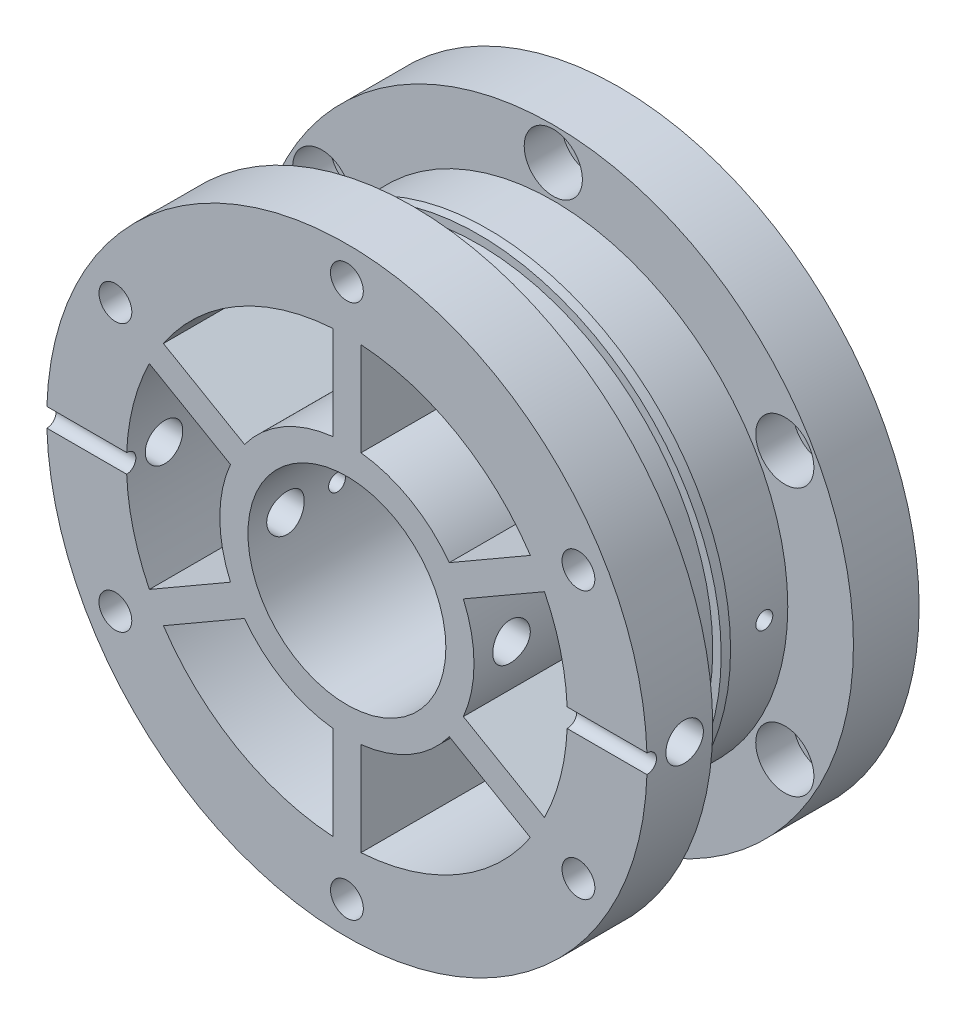
from build123d import *

# Parameters (mm, degrees)
SKETCH4_R                = 10.55
CUT_EXTRUDE1_DEPTH       = 45
SKETCH5_R                = 1.75
CUT_EXTRUDE2_DEPTH       = 20
SKETCH14_R               = 3.1
CUT_EXTRUDE9_DEPTH       = 4
CIRPATTERN1_COUNT        = 6
MIRROR1_COPY_1_SKETCH_R  = 1.75
MIRROR1_COPY_1_DEPTH     = 20
MIRROR1_COPY_2_SKETCH_R  = 1.75
MIRROR1_COPY_2_DEPTH     = 20
MIRROR1_COPY_3_SKETCH_R  = 1.75
MIRROR1_COPY_3_DEPTH     = 20
MIRROR1_COPY_4_SKETCH_R  = 1.75
MIRROR1_COPY_4_DEPTH     = 20
MIRROR1_COPY_5_SKETCH_R  = 1.75
MIRROR1_COPY_5_DEPTH     = 20
MIRROR1_COPY_6_SKETCH_R  = 3.1
MIRROR1_COPY_6_DEPTH     = 4
MIRROR1_COPY_7_SKETCH_R  = 3.1
MIRROR1_COPY_7_DEPTH     = 4
MIRROR1_COPY_8_SKETCH_R  = 3.1
MIRROR1_COPY_8_DEPTH     = 4
MIRROR1_COPY_9_SKETCH_R  = 3.1
MIRROR1_COPY_9_DEPTH     = 4
MIRROR1_COPY_10_SKETCH_R = 3.1
MIRROR1_COPY_10_DEPTH    = 4
MIRROR1_COPY_11_SKETCH_R = 3.1
MIRROR1_COPY_11_DEPTH    = 4
SKETCH6_R                = 0.9
CUT_EXTRUDE3_DEPTH       = 50
SKETCH6_3_R              = 0.9
CUT_EXTRUDE4_DEPTH       = 50
CUT_EXTRUDE5_DEPTH       = 48.521047999
CUT_EXTRUDE5_DEPTH_BACK  = 48.521047999
SKETCH7_R                = 2
SKETCH11_R               = 1
CUT_EXTRUDE8_DEPTH       = 13


with BuildPart() as part:
    # Sketch2 → Revolve1 (revolve)
    with BuildSketch(Plane(origin=(0, 0, 0), x_dir=(0, 0, -1), z_dir=(1, 0, 0))):
        Polygon((0, 0), (0, 25), (-7.5, 25), (-7.5, 32), (-14.5, 32), (-14.5, 0), align=None)
    revolve1 = revolve(axis=Axis((0, 0, 14.5), (0, 0, -1)))

    # Sketch4 → Cut-Extrude1 (cut)
    with BuildSketch(Plane.XY.offset(14.5)):
        with BuildLine():
            Line((-1.5, 13.466718234), (-1.5, 23.452078799))
            ThreePointArc((-1.5, 23.452078799), (-11.75, 20.351596989), (-19.560096012, 13.025077505))
            Line((-19.560096012, 13.025077505), (-10.912520096, 8.032397223))
            ThreePointArc((-10.912520096, 8.032397223), (-6.775, 11.734644221), (-1.5, 13.466718234))
        make_face()
        with BuildLine():
            ThreePointArc((19.560096012, 13.025077505), (11.75, 20.351596989), (1.5, 23.452078799))
            Line((1.5, 23.452078799), (1.5, 13.466718234))
            ThreePointArc((1.5, 13.466718234), (6.775, 11.734644221), (10.912520096, 8.032397223))
            Line((10.912520096, 8.032397223), (19.560096012, 13.025077505))
        make_face()
        with BuildLine():
            Line((-12.412520096, 5.434321011), (-21.060096012, 10.427001294))
            ThreePointArc((-21.060096012, 10.427001294), (-23.5, 0), (-21.060096012, -10.427001294))
            Line((-21.060096012, -10.427001294), (-12.412520096, -5.434321011))
            ThreePointArc((-12.412520096, -5.434321011), (-13.55, 0), (-12.412520096, 5.434321011))
        make_face()
        with BuildLine():
            ThreePointArc((21.060096012, -10.427001294), (23.5, 0), (21.060096012, 10.427001294))
            Line((21.060096012, 10.427001294), (12.412520096, 5.434321011))
            ThreePointArc((12.412520096, 5.434321011), (13.55, 0), (12.412520096, -5.434321011))
            Line((12.412520096, -5.434321011), (21.060096012, -10.427001294))
        make_face()
        with BuildLine():
            Line((-10.912520096, -8.032397223), (-19.560096012, -13.025077505))
            ThreePointArc((-19.560096012, -13.025077505), (-11.75, -20.351596989), (-1.5, -23.452078799))
            Line((-1.5, -23.452078799), (-1.5, -13.466718234))
            ThreePointArc((-1.5, -13.466718234), (-6.775, -11.734644221), (-10.912520096, -8.032397223))
        make_face()
        with BuildLine():
            ThreePointArc((1.5, -23.452078799), (11.75, -20.351596989), (19.560096012, -13.025077505))
            Line((19.560096012, -13.025077505), (10.912520096, -8.032397223))
            ThreePointArc((10.912520096, -8.032397223), (6.775, -11.734644221), (1.5, -13.466718234))
            Line((1.5, -13.466718234), (1.5, -23.452078799))
        make_face()
        Circle(SKETCH4_R)
    cut_extrude1 = extrude(amount=-CUT_EXTRUDE1_DEPTH, mode=Mode.SUBTRACT)

    # Sketch5 → Cut-Extrude2 (cut)
    with BuildSketch(Plane.XY.offset(14.5)):
        with Locations((0, 28.5)):
            Circle(SKETCH5_R)
    cut_extrude2 = extrude(amount=-CUT_EXTRUDE2_DEPTH, mode=Mode.SUBTRACT)

    # Sketch14 → Cut-Extrude9 (cut)
    with BuildSketch(Plane(origin=(0, 0, 7.5), x_dir=(-1, 0, 0), z_dir=(0, 0, -1))):
        with Locations((0, 28.5)):
            Circle(SKETCH14_R)
    cut_extrude9 = extrude(amount=-CUT_EXTRUDE9_DEPTH, mode=Mode.SUBTRACT)

    # CirPattern1: Cut-Extrude2, Cut-Extrude9 ×6 about axis
    cirpattern1_axis = Axis((0, 0, 50.486037223), (0, 0, -1))
    add([cut_extrude2.rotate(cirpattern1_axis, i * 360 / CIRPATTERN1_COUNT) for i in range(1, CIRPATTERN1_COUNT)], mode=Mode.SUBTRACT)
    add([cut_extrude9.rotate(cirpattern1_axis, i * 360 / CIRPATTERN1_COUNT) for i in range(1, CIRPATTERN1_COUNT)], mode=Mode.SUBTRACT)

    # Mirror1: Revolve1, Cut-Extrude1, Cut-Extrude2 across plane
    add(revolve1.mirror(Plane.XY))
    add(cut_extrude1.mirror(Plane.XY), mode=Mode.SUBTRACT)
    add(cut_extrude2.mirror(Plane.XY), mode=Mode.SUBTRACT)

    # Mirror1 copy 1 sketch → Mirror1 copy 1 (cut)
    with BuildSketch(Plane(origin=(0, 0, -14.5), x_dir=(0.5000000000000001, -0.8660254037844386, 0), z_dir=(0, 0, -1))):
        with Locations((0, -28.5)):
            Circle(MIRROR1_COPY_1_SKETCH_R)
    extrude(amount=-MIRROR1_COPY_1_DEPTH, mode=Mode.SUBTRACT)

    # Mirror1 copy 2 sketch → Mirror1 copy 2 (cut)
    with BuildSketch(Plane(origin=(0, 0, -14.5), x_dir=(-0.4999999999999998, -0.8660254037844387, 0), z_dir=(0, 0, -1))):
        with Locations((0, -28.5)):
            Circle(MIRROR1_COPY_2_SKETCH_R)
    extrude(amount=-MIRROR1_COPY_2_DEPTH, mode=Mode.SUBTRACT)

    # Mirror1 copy 3 sketch → Mirror1 copy 3 (cut)
    with BuildSketch(Plane(origin=(0, 0, -14.5), x_dir=(-1, 0, 0), z_dir=(0, 0, -1))):
        with Locations((0, -28.5)):
            Circle(MIRROR1_COPY_3_SKETCH_R)
    extrude(amount=-MIRROR1_COPY_3_DEPTH, mode=Mode.SUBTRACT)

    # Mirror1 copy 4 sketch → Mirror1 copy 4 (cut)
    with BuildSketch(Plane(origin=(0, 0, -14.5), x_dir=(-0.5000000000000004, 0.8660254037844384, 0), z_dir=(0, 0, -1))):
        with Locations((0, -28.5)):
            Circle(MIRROR1_COPY_4_SKETCH_R)
    extrude(amount=-MIRROR1_COPY_4_DEPTH, mode=Mode.SUBTRACT)

    # Mirror1 copy 5 sketch → Mirror1 copy 5 (cut)
    with BuildSketch(Plane(origin=(0, 0, -14.5), x_dir=(0.5000000000000001, 0.8660254037844386, 0), z_dir=(0, 0, -1))):
        with Locations((0, -28.5)):
            Circle(MIRROR1_COPY_5_SKETCH_R)
    extrude(amount=-MIRROR1_COPY_5_DEPTH, mode=Mode.SUBTRACT)

    # Mirror1 copy 6 sketch → Mirror1 copy 6 (cut)
    with BuildSketch(Plane(origin=(0, 0, -7.5), x_dir=(-0.5000000000000001, 0.8660254037844386, 0), z_dir=(0, 0, 1))):
        with Locations((0, -28.5)):
            Circle(MIRROR1_COPY_6_SKETCH_R)
    extrude(amount=-MIRROR1_COPY_6_DEPTH, mode=Mode.SUBTRACT)

    # Mirror1 copy 7 sketch → Mirror1 copy 7 (cut)
    with BuildSketch(Plane(origin=(0, 0, -7.5), x_dir=(0.4999999999999998, 0.8660254037844387, 0), z_dir=(0, 0, 1))):
        with Locations((0, -28.5)):
            Circle(MIRROR1_COPY_7_SKETCH_R)
    extrude(amount=-MIRROR1_COPY_7_DEPTH, mode=Mode.SUBTRACT)

    # Mirror1 copy 8 sketch → Mirror1 copy 8 (cut)
    with BuildSketch(Plane.XY.offset(-7.5)):
        with Locations((0, -28.5)):
            Circle(MIRROR1_COPY_8_SKETCH_R)
    extrude(amount=-MIRROR1_COPY_8_DEPTH, mode=Mode.SUBTRACT)

    # Mirror1 copy 9 sketch → Mirror1 copy 9 (cut)
    with BuildSketch(Plane(origin=(0, 0, -7.5), x_dir=(0.5000000000000004, -0.8660254037844384, 0), z_dir=(0, 0, 1))):
        with Locations((0, -28.5)):
            Circle(MIRROR1_COPY_9_SKETCH_R)
    extrude(amount=-MIRROR1_COPY_9_DEPTH, mode=Mode.SUBTRACT)

    # Mirror1 copy 10 sketch → Mirror1 copy 10 (cut)
    with BuildSketch(Plane(origin=(0, 0, -7.5), x_dir=(-0.5000000000000001, -0.8660254037844386, 0), z_dir=(0, 0, 1))):
        with Locations((0, -28.5)):
            Circle(MIRROR1_COPY_10_SKETCH_R)
    extrude(amount=-MIRROR1_COPY_10_DEPTH, mode=Mode.SUBTRACT)

    # Mirror1 copy 11 sketch → Mirror1 copy 11 (cut)
    with BuildSketch(Plane(origin=(0, 0, -7.5), x_dir=(-1, 0, 0), z_dir=(0, 0, 1))):
        with Locations((0, -28.5)):
            Circle(MIRROR1_COPY_11_SKETCH_R)
    extrude(amount=-MIRROR1_COPY_11_DEPTH, mode=Mode.SUBTRACT)

    # Sketch6 → Cut-Extrude3 (cut)
    with BuildSketch(Plane(origin=(0, 0, 0), x_dir=(0, 0, -1), z_dir=(1, 0, 0))):
        with Locations((-5, 0)):
            Circle(SKETCH6_R)
    extrude(amount=-CUT_EXTRUDE3_DEPTH, mode=Mode.SUBTRACT)

    # Sketch6<3> → Cut-Extrude4 (cut)
    with BuildSketch(Plane(origin=(0, 0, 0), x_dir=(0, 0, -1), z_dir=(1, 0, 0))):
        with Locations((5, 0)):
            Circle(SKETCH6_3_R)
    extrude(amount=CUT_EXTRUDE4_DEPTH, mode=Mode.SUBTRACT)

    # Sketch7 → Cut-Extrude5 (cut, two sides: drawn at the far end of the back side and taken through both)
    with BuildSketch(Plane(origin=(0, 0, 0), x_dir=(0, 0, -1), z_dir=(1, 0, 0)).offset(-CUT_EXTRUDE5_DEPTH_BACK)):
        with Locations((-10.5, 0)):
            Circle(SKETCH7_R)
    extrude(amount=CUT_EXTRUDE5_DEPTH + CUT_EXTRUDE5_DEPTH_BACK, mode=Mode.SUBTRACT)

    # Sketch11 → Cut-Extrude8 (cut)
    with BuildSketch(Plane.ZY.offset(32)):
        with Locations((14.5, 0)):
            Circle(SKETCH11_R)
    cut_extrude8 = extrude(amount=-CUT_EXTRUDE8_DEPTH, mode=Mode.SUBTRACT)

    # Mirror2: Cut-Extrude8 across plane
    add(cut_extrude8.mirror(Plane(origin=(0, 0, 0), x_dir=(0, 0, 1), z_dir=(1, 0, 0))), mode=Mode.SUBTRACT)

    # Sketch13 → Revolve3 (revolve)
    with BuildSketch(Plane(origin=(0, 0, 0), x_dir=(1, 0, 0), z_dir=(0, 1, 0))):
        Polygon((25, 0), (25, -0.5), (25.9, -0.5), (25.9, 0.5), (25, 0.5), align=None)
    revolve(axis=Axis((0, 0, 50.486037223), (0, 0, -1)))


solid = part.part
